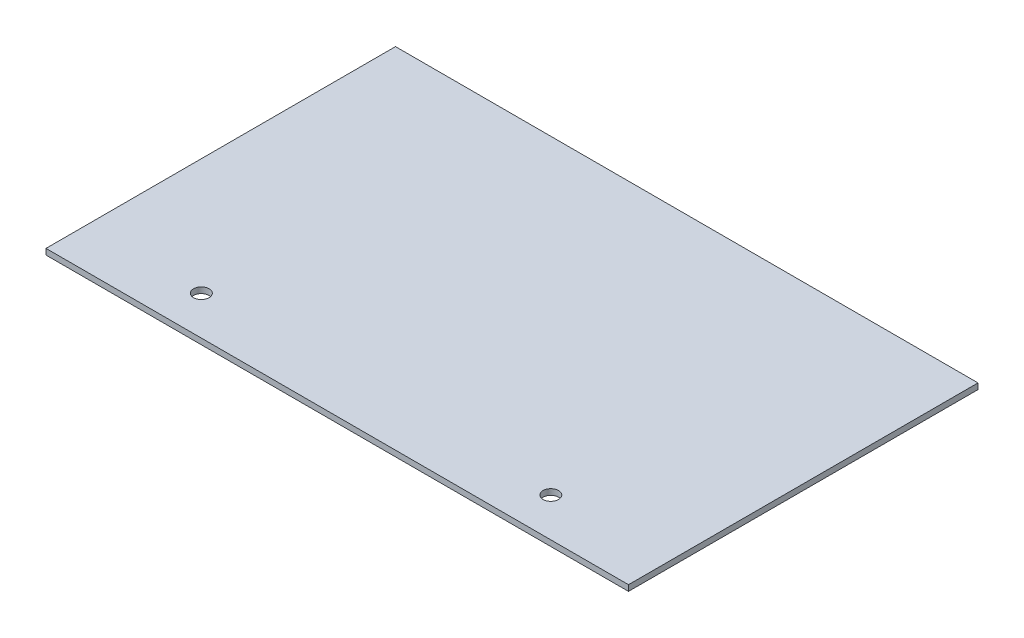
from build123d import *

# Parameters (mm, degrees)
SKETCH_1_W          = 300
SKETCH_1_H          = 180
EXTRUDE_1_DEPTH     = 3
SKETCH_2_R          = 4
CUT_EXTRUDE_1_DEPTH = 350.869975848


with BuildPart() as part:
    # 草图1 → 凸台-拉伸1 (new body)
    with BuildSketch(Plane(origin=(0, 0, 0), x_dir=(1, 0, 0), z_dir=(0, 1, 0))):
        with Locations((150, -90)):
            Rectangle(SKETCH_1_W, SKETCH_1_H)
    extrude(amount=EXTRUDE_1_DEPTH)

    # 草图2 → 切除-拉伸1 (cut, through all)
    with BuildSketch(Plane(origin=(0, 3, 0), x_dir=(1, 0, 0), z_dir=(0, 1, 0))):
        with Locations(Location((60, -160, 0), (0, 0, 270))):
            Circle(SKETCH_2_R)
        with Locations(Location((240, -160, 0), (0, 0, 270))):
            Circle(SKETCH_2_R)
    extrude(amount=-CUT_EXTRUDE_1_DEPTH, mode=Mode.SUBTRACT)


solid = part.part
